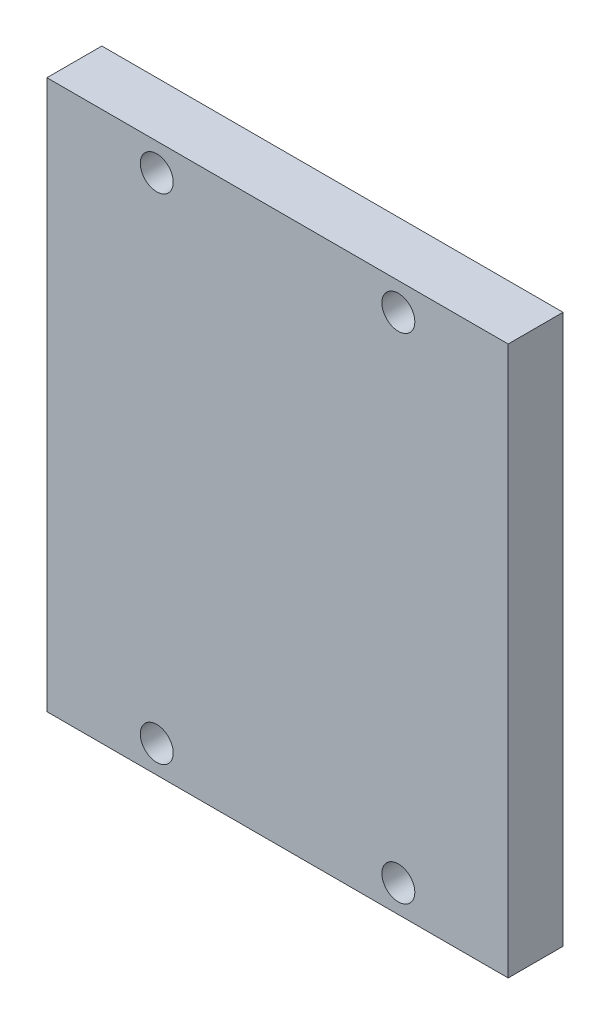
from build123d import *

# Parameters (mm, degrees)
SKETCH1_W           = 42
SKETCH1_H           = 25
SKETCH1_R           = 1.5
BOSS_EXTRUDE1_DEPTH = 5


with BuildPart() as part:
    # Sketch1 → Boss-Extrude1 (new body)
    with BuildSketch(Plane.XY):
        with Locations((21, 12.5)):
            Rectangle(SKETCH1_W, SKETCH1_H)
        with Locations((10, 2.5)):
            Circle(SKETCH1_R, mode=Mode.SUBTRACT)
        with Locations((32, 2.5)):
            Circle(SKETCH1_R, mode=Mode.SUBTRACT)
    boss_extrude1 = extrude(amount=BOSS_EXTRUDE1_DEPTH)

    # Mirror1: Boss-Extrude1 across plane
    add(boss_extrude1.mirror(Plane(origin=(0, 25, 5), x_dir=(0, 0, 1), z_dir=(0, -1, 0))))


solid = part.part
